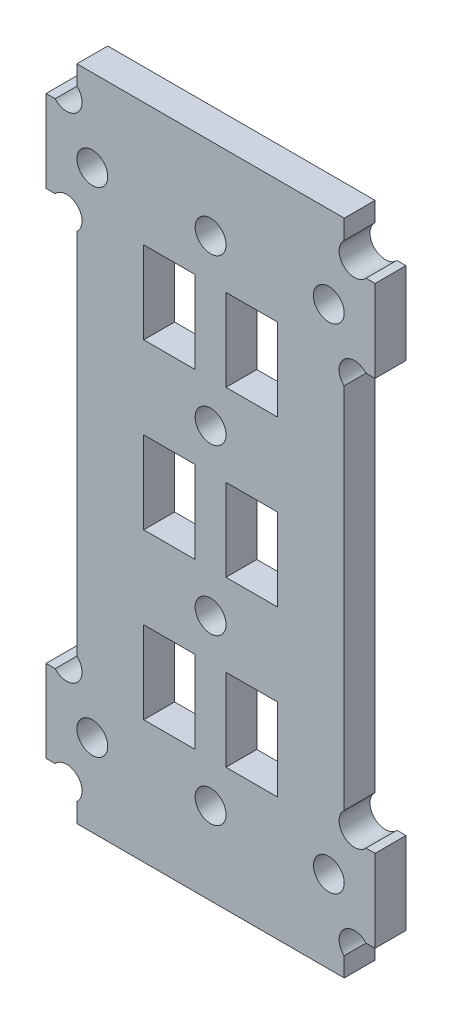
from build123d import *

# Parameters (mm, degrees)
SKETCH_1_W                = 32
SKETCH_1_H                = 64
EXTRUDE_1_DEPTH           = 3
SKETCH_2_W                = 2.5
SKETCH_2_H                = 4
CUT_EXTRUDE_1_DEPTH       = 36.902646142
MIRROR_2_COPY_1_SKETCH_W  = 2.5
MIRROR_2_COPY_1_SKETCH_H  = 4
MIRROR_2_COPY_1_DEPTH     = 36.902646142
SKETCH_4_W                = 3
SKETCH_4_H                = 8
CUT_EXTRUDE_3_DEPTH       = 10
SKETCH_6_W                = 3
SKETCH_6_H                = 4
CUT_EXTRUDE_5_DEPTH       = 36.902646142
MIRROR_9_COPY_1_SKETCH_W  = 3
MIRROR_9_COPY_1_SKETCH_H  = 4
MIRROR_9_COPY_1_DEPTH     = 36.902646142
SKETCH_8_R                = 1.5
CUT_EXTRUDE_6_DEPTH       = 36.902646142
MIRROR_11_COPY_1_SKETCH_R = 1.5
MIRROR_11_COPY_1_DEPTH    = 36.902646142
SKETCH_10_R               = 1.5
CUT_EXTRUDE_8_DEPTH       = 36.902646142
MIRROR_15_COPY_1_SKETCH_R = 1.5
MIRROR_15_COPY_1_DEPTH    = 36.902646142
SKETCH_11_R               = 1.5
CUT_EXTRUDE_9_DEPTH       = 36.902646142
MIRROR_17_COPY_1_SKETCH_R = 1.5
MIRROR_17_COPY_1_DEPTH    = 36.902646142
SKETCH_12_W               = 3
SKETCH_12_H               = 8
CUT_EXTRUDE_10_DEPTH      = 36.902646142
MIRROR_19_COPY_1_SKETCH_W = 3
MIRROR_19_COPY_1_SKETCH_H = 8
MIRROR_19_COPY_1_DEPTH    = 36.902646142
SKETCH_13_R               = 1.5
CUT_EXTRUDE_11_DEPTH      = 36.902646142
MIRROR_21_COPY_1_SKETCH_R = 1.5
MIRROR_21_COPY_1_DEPTH    = 36.902646142
SKETCH_14_W               = 5
SKETCH_14_H               = 8
CUT_EXTRUDE_12_DEPTH      = 36.902646142
SKETCH_15_R               = 1.5
CUT_EXTRUDE_13_DEPTH      = 36.902646142
EXTRUDE_START             = -3
SKETCH_16_R               = 1.5
EXTRUDE_2_DEPTH           = 3
SKETCH_17_R               = 1.5
EXTRUDE_3_DEPTH           = 3
SKETCH_18_W               = 3.671762992
SKETCH_18_H               = 30.671396723
SKETCH_18_W_2             = 3.904122058
CUT_EXTRUDE_14_DEPTH      = 36.902646142


with BuildPart() as part:
    # 草图1 → 凸台-拉伸1 (new body)
    with BuildSketch(Plane.XY):
        Rectangle(SKETCH_1_W, SKETCH_1_H)
    extrude(amount=EXTRUDE_1_DEPTH)

    # 草图2 → 切除-拉伸1 (cut, through all)
    with BuildSketch(Plane.XY.offset(3)):
        Polygon((4, 16), (4, 12), (6.5, 12), (6.5, 20), (1.5, 20), (1.5, 16), align=None)
        with Locations((2.75, 14)):
            Rectangle(SKETCH_2_W, SKETCH_2_H)
    cut_extrude_1 = extrude(amount=-CUT_EXTRUDE_1_DEPTH, mode=Mode.SUBTRACT)

    # 镜向1: 切除-拉伸1 across plane
    add(cut_extrude_1.mirror(Plane(origin=(0, 0, 0), x_dir=(0, 0, 1), z_dir=(1, 0, 0))), mode=Mode.SUBTRACT)

    # 镜向2: 切除-拉伸1 across plane
    add(cut_extrude_1.mirror(Plane.ZX), mode=Mode.SUBTRACT)

    # 镜向2 copy 1 sketch → 镜向2 copy 1 (cut, through all)
    with BuildSketch(Plane(origin=(0, 0, 3), x_dir=(-1, 0, 0), z_dir=(0, 0, 1))):
        Polygon((4, 16), (4, 12), (6.5, 12), (6.5, 20), (1.5, 20), (1.5, 16), align=None)
        with Locations((2.75, 14)):
            Rectangle(MIRROR_2_COPY_1_SKETCH_W, MIRROR_2_COPY_1_SKETCH_H)
    extrude(amount=-MIRROR_2_COPY_1_DEPTH, mode=Mode.SUBTRACT)

    # 草图4 → 切除-拉伸3 (cut)
    with BuildSketch(Plane.XY.offset(3)):
        with Locations((14.5, 0)):
            Rectangle(SKETCH_4_W, SKETCH_4_H)
    cut_extrude_3 = extrude(amount=-CUT_EXTRUDE_3_DEPTH, mode=Mode.SUBTRACT)

    # 镜向5: 切除-拉伸3 across plane
    add(cut_extrude_3.mirror(Plane(origin=(0, 0, 0), x_dir=(0, 0, 1), z_dir=(1, 0, 0))), mode=Mode.SUBTRACT)

    # 草图6 → 切除-拉伸5 (cut, through all)
    with BuildSketch(Plane.XY.offset(3)):
        with Locations((14.5, 30)):
            Rectangle(SKETCH_6_W, SKETCH_6_H)
    cut_extrude_5 = extrude(amount=-CUT_EXTRUDE_5_DEPTH, mode=Mode.SUBTRACT)

    # 镜向8: 切除-拉伸5 across plane
    add(cut_extrude_5.mirror(Plane.ZX), mode=Mode.SUBTRACT)

    # 镜向9: 切除-拉伸5 across plane
    add(cut_extrude_5.mirror(Plane(origin=(0, 0, 0), x_dir=(0, 0, 1), z_dir=(1, 0, 0))), mode=Mode.SUBTRACT)

    # 镜向9 copy 1 sketch → 镜向9 copy 1 (cut, through all)
    with BuildSketch(Plane(origin=(0, 0, 3), x_dir=(-1, 0, 0), z_dir=(0, 0, 1))):
        with Locations((14.5, 30)):
            Rectangle(MIRROR_9_COPY_1_SKETCH_W, MIRROR_9_COPY_1_SKETCH_H)
    extrude(amount=-MIRROR_9_COPY_1_DEPTH, mode=Mode.SUBTRACT)

    # 草图8 → 切除-拉伸6 (cut, through all)
    with BuildSketch(Plane.XY.offset(3)):
        with Locations((14, 29)):
            Circle(SKETCH_8_R)
    cut_extrude_6 = extrude(amount=-CUT_EXTRUDE_6_DEPTH, mode=Mode.SUBTRACT)

    # 镜向10: 切除-拉伸6 across plane
    add(cut_extrude_6.mirror(Plane(origin=(0, 0, 0), x_dir=(0, 0, 1), z_dir=(1, 0, 0))), mode=Mode.SUBTRACT)

    # 镜向11: 切除-拉伸6 across plane
    add(cut_extrude_6.mirror(Plane.ZX), mode=Mode.SUBTRACT)

    # 镜向11 copy 1 sketch → 镜向11 copy 1 (cut, through all)
    with BuildSketch(Plane(origin=(0, 0, 3), x_dir=(-1, 0, 0), z_dir=(0, 0, 1))):
        with Locations((14, 29)):
            Circle(MIRROR_11_COPY_1_SKETCH_R)
    extrude(amount=-MIRROR_11_COPY_1_DEPTH, mode=Mode.SUBTRACT)

    # 草图10 → 切除-拉伸8 (cut, through all)
    with BuildSketch(Plane.XY.offset(3)):
        with Locations((-14, 3)):
            Circle(SKETCH_10_R)
    cut_extrude_8 = extrude(amount=-CUT_EXTRUDE_8_DEPTH, mode=Mode.SUBTRACT)

    # 镜向14: 切除-拉伸8 across plane
    add(cut_extrude_8.mirror(Plane.ZX), mode=Mode.SUBTRACT)

    # 镜向15: 切除-拉伸8 across plane
    add(cut_extrude_8.mirror(Plane(origin=(0, 0, 0), x_dir=(0, 0, 1), z_dir=(1, 0, 0))), mode=Mode.SUBTRACT)

    # 镜向15 copy 1 sketch → 镜向15 copy 1 (cut, through all)
    with BuildSketch(Plane(origin=(0, 0, 3), x_dir=(-1, 0, 0), z_dir=(0, 0, 1))):
        with Locations((-14, 3)):
            Circle(MIRROR_15_COPY_1_SKETCH_R)
    extrude(amount=-MIRROR_15_COPY_1_DEPTH, mode=Mode.SUBTRACT)

    # 草图11 → 切除-拉伸9 (cut, through all)
    with BuildSketch(Plane.XY.offset(3)):
        with Locations((-11.5, -8)):
            Circle(SKETCH_11_R)
        with Locations((-11.5, -24)):
            Circle(SKETCH_11_R)
    cut_extrude_9 = extrude(amount=-CUT_EXTRUDE_9_DEPTH, mode=Mode.SUBTRACT)

    # 镜向16: 切除-拉伸9 across plane
    add(cut_extrude_9.mirror(Plane(origin=(0, 0, 0), x_dir=(0, 0, 1), z_dir=(1, 0, 0))), mode=Mode.SUBTRACT)

    # 镜向17: 切除-拉伸9 across plane
    add(cut_extrude_9.mirror(Plane.ZX), mode=Mode.SUBTRACT)

    # 镜向17 copy 1 sketch → 镜向17 copy 1 (cut, through all)
    with BuildSketch(Plane(origin=(0, 0, 3), x_dir=(-1, 0, 0), z_dir=(0, 0, 1))):
        with Locations((-11.5, -8)):
            Circle(MIRROR_17_COPY_1_SKETCH_R)
        with Locations((-11.5, -24)):
            Circle(MIRROR_17_COPY_1_SKETCH_R)
    extrude(amount=-MIRROR_17_COPY_1_DEPTH, mode=Mode.SUBTRACT)

    # 草图12 → 切除-拉伸10 (cut, through all)
    with BuildSketch(Plane(origin=(0, 0, 0), x_dir=(-1, 0, 0), z_dir=(0, 0, -1))):
        with Locations((-14.5, 16)):
            Rectangle(SKETCH_12_W, SKETCH_12_H)
    cut_extrude_10 = extrude(amount=-CUT_EXTRUDE_10_DEPTH, mode=Mode.SUBTRACT)

    # 镜向18: 切除-拉伸10 across plane
    add(cut_extrude_10.mirror(Plane(origin=(0, 0, 0), x_dir=(0, 0, 1), z_dir=(1, 0, 0))), mode=Mode.SUBTRACT)

    # 镜向19: 切除-拉伸10 across plane
    add(cut_extrude_10.mirror(Plane.ZX), mode=Mode.SUBTRACT)

    # 镜向19 copy 1 sketch → 镜向19 copy 1 (cut, through all)
    with BuildSketch(Plane(origin=(0, 0, 0), x_dir=(1, 0, 0), z_dir=(0, 0, -1))):
        with Locations((-14.5, 16)):
            Rectangle(MIRROR_19_COPY_1_SKETCH_W, MIRROR_19_COPY_1_SKETCH_H)
    extrude(amount=-MIRROR_19_COPY_1_DEPTH, mode=Mode.SUBTRACT)

    # 草图13 → 切除-拉伸11 (cut, through all)
    with BuildSketch(Plane(origin=(0, 0, 0), x_dir=(-1, 0, 0), z_dir=(0, 0, -1))):
        with Locations((-14, 19)):
            Circle(SKETCH_13_R)
        with Locations((-14, 13)):
            Circle(SKETCH_13_R)
    cut_extrude_11 = extrude(amount=-CUT_EXTRUDE_11_DEPTH, mode=Mode.SUBTRACT)

    # 镜向20: 切除-拉伸11 across plane
    add(cut_extrude_11.mirror(Plane(origin=(0, 0, 0), x_dir=(0, 0, 1), z_dir=(1, 0, 0))), mode=Mode.SUBTRACT)

    # 镜向21: 切除-拉伸11 across plane
    add(cut_extrude_11.mirror(Plane.ZX), mode=Mode.SUBTRACT)

    # 镜向21 copy 1 sketch → 镜向21 copy 1 (cut, through all)
    with BuildSketch(Plane(origin=(0, 0, 0), x_dir=(1, 0, 0), z_dir=(0, 0, -1))):
        with Locations((-14, 19)):
            Circle(MIRROR_21_COPY_1_SKETCH_R)
        with Locations((-14, 13)):
            Circle(MIRROR_21_COPY_1_SKETCH_R)
    extrude(amount=-MIRROR_21_COPY_1_DEPTH, mode=Mode.SUBTRACT)

    # 草图14 → 切除-拉伸12 (cut, through all)
    with BuildSketch(Plane(origin=(0, 0, 0), x_dir=(-1, 0, 0), z_dir=(0, 0, -1))):
        with Locations((4, 0)):
            Rectangle(SKETCH_14_W, SKETCH_14_H)
    cut_extrude_12 = extrude(amount=-CUT_EXTRUDE_12_DEPTH, mode=Mode.SUBTRACT)

    # 镜向22: 切除-拉伸12 across plane
    add(cut_extrude_12.mirror(Plane(origin=(0, 0, 0), x_dir=(0, 0, 1), z_dir=(1, 0, 0))), mode=Mode.SUBTRACT)

    # 草图15 → 切除-拉伸13 (cut, through all)
    with BuildSketch(Plane(origin=(0, 0, 0), x_dir=(-1, 0, 0), z_dir=(0, 0, -1))):
        with Locations((0, 8)):
            Circle(SKETCH_15_R)
        with Locations((0, 24)):
            Circle(SKETCH_15_R)
    cut_extrude_13 = extrude(amount=-CUT_EXTRUDE_13_DEPTH, mode=Mode.SUBTRACT)

    # 镜向23: 切除-拉伸13 across plane
    add(cut_extrude_13.mirror(Plane.ZX), mode=Mode.SUBTRACT)

    # 草图16 → 凸台-拉伸2 (add)
    with BuildSketch(Plane(origin=(0, 0, 0), x_dir=(-1, 0, 0), z_dir=(0, 0, -1)).offset(EXTRUDE_START)):
        with Locations((11.5, 8)):
            Circle(SKETCH_16_R)
        with Locations((-11.5, 8)):
            Circle(SKETCH_16_R)
        with Locations((-11.5, -8)):
            Circle(SKETCH_16_R)
        with Locations((11.5, -8)):
            Circle(SKETCH_16_R)
    extrude(amount=EXTRUDE_2_DEPTH)

    # 草图17 → 凸台-拉伸3 (add)
    with BuildSketch(Plane.XY.offset(3)):
        with Locations((14, 13)):
            Circle(SKETCH_17_R)
        with Locations((14, 3)):
            Circle(SKETCH_17_R)
        with Locations((14, -3)):
            Circle(SKETCH_17_R)
        with Locations((14, -13)):
            Circle(SKETCH_17_R)
        with Locations((-14, -13)):
            Circle(SKETCH_17_R)
        with Locations((-14, -3)):
            Circle(SKETCH_17_R)
        with Locations((-14, 3)):
            Circle(SKETCH_17_R)
        with Locations((-14, 13)):
            Circle(SKETCH_17_R)
    extrude(amount=-EXTRUDE_3_DEPTH)

    # 草图18 → 切除-拉伸14 (cut, through all)
    with BuildSketch(Plane.XY.offset(3)):
        with Locations((14.835881496, 0.174269299)):
            Rectangle(SKETCH_18_W, SKETCH_18_H)
        with Locations((-14.952061029, 0.174269299)):
            Rectangle(SKETCH_18_W_2, SKETCH_18_H)
    extrude(amount=-CUT_EXTRUDE_14_DEPTH, mode=Mode.SUBTRACT)


solid = part.part
